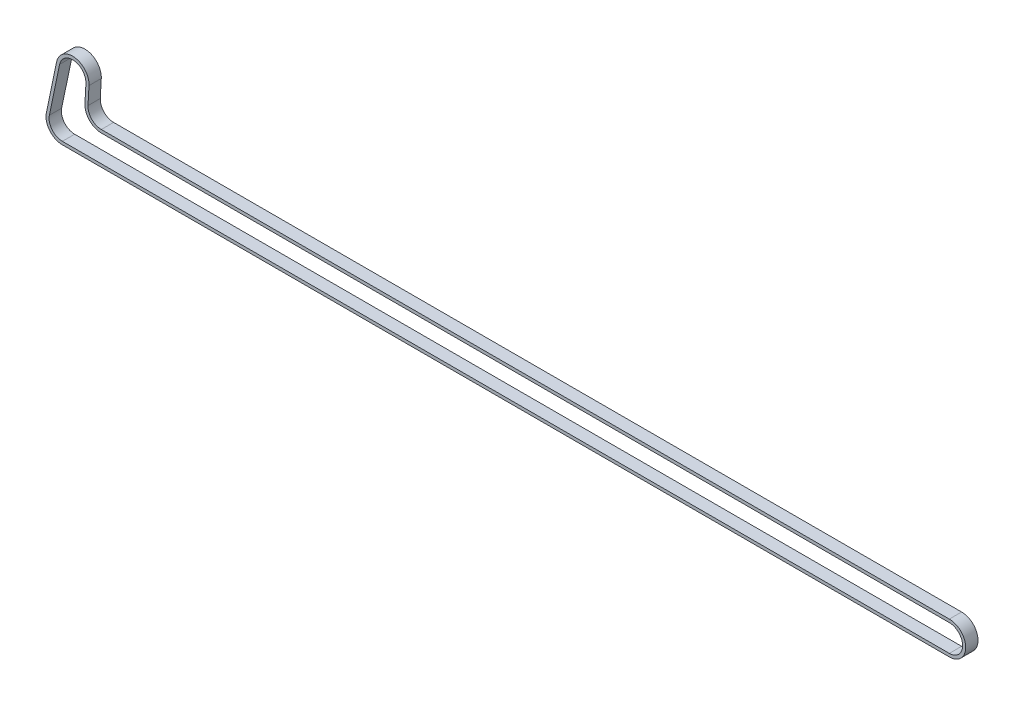
from build123d import *

# Parameters (mm, degrees)
EXTRUDE_THIN1_DEPTH = 3


with BuildPart() as part:
    # Sketch1 → Extrude-Thin1 (new, symmetric)
    with BuildSketch(Plane.XY):
        with BuildLine():
            Line((-219.331843358, 32.631634033), (-224.331843358, 8.631634033))
            ThreePointArc((-224.331843358, 8.631634033), (-222.706974797, 1.952875683), (-216.5, -1))
            Line((-216.5, -1), (216.5, -1))
            ThreePointArc((216.5, -1), (224.5, 7), (216.5, 15))
            Line((216.5, 15), (-197.5, 15))
            ThreePointArc((-197.5, 15), (-202.220562203, 17.031634248), (-203.990214915, 21.856525388))
            Line((-203.990214915, 21.856525388), (-203.512043181, 30.561199523))
            ThreePointArc((-203.512043181, 30.561199523), (-210.461844126, 38.932353521), (-219.331843358, 32.631634033))
        make_face()
        with BuildLine():
            Line((-217.863372728, 32.325702652), (-222.863372728, 8.325702652))
            ThreePointArc((-222.863372728, 8.325702652), (-221.543167023, 2.899211493), (-216.5, 0.5))
            Line((-216.5, 0.5), (216.5, 0.5))
            ThreePointArc((216.5, 0.5), (223, 7), (216.5, 13.5))
            Line((216.5, 13.5), (-197.5, 13.5))
            ThreePointArc((-197.5, 13.5), (-203.309922711, 16.000472921), (-205.487956819, 21.938800477))
            Line((-205.487956819, 21.938800477), (-205.009785085, 30.643474612))
            ThreePointArc((-205.009785085, 30.643474612), (-210.656498352, 37.445037236), (-217.863372728, 32.325702652))
        make_face(mode=Mode.SUBTRACT)
    extrude(amount=EXTRUDE_THIN1_DEPTH, both=True)


solid = part.part
